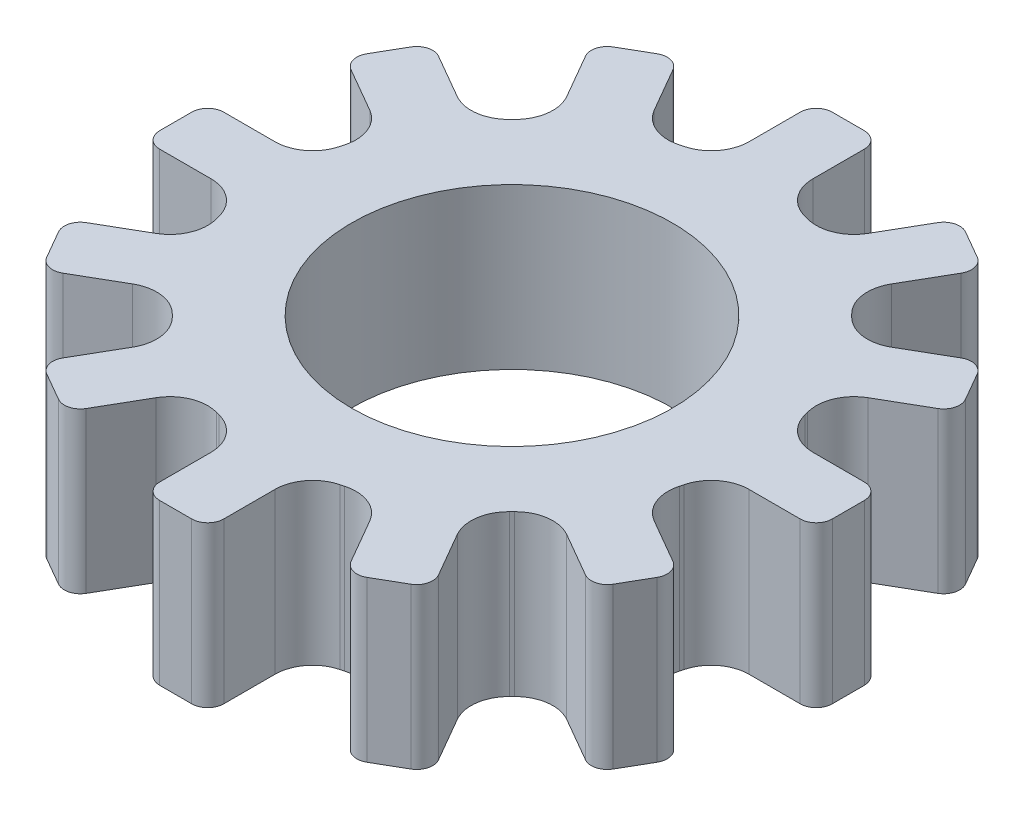
from build123d import *

# Parameters (mm, degrees)
SKETCH1_R           = 6.3627
BOSS_EXTRUDE1_DEPTH = 6.35


with BuildPart() as part:
    # Sketch1 → Boss-Extrude1 (new body)
    with BuildSketch(Plane(origin=(0, 0, 0), x_dir=(1, 0, 0), z_dir=(0, 1, 0))):
        with BuildLine():
            Line((-1.27, 10.670267616), (-1.27, 12.7))
            ThreePointArc((-1.27, 12.7), (-1.084012806, 13.149012806), (-0.635, 13.335))
            Line((-0.635, 13.335), (0.635, 13.335))
            ThreePointArc((0.635, 13.335), (1.084012806, 13.149012806), (1.27, 12.7))
            Line((1.27, 12.7), (1.27, 10.670267616))
            ThreePointArc((1.27, 10.670267616), (1.583306834, 9.753271395), (2.392223502, 9.219701281))
            Line((2.392223502, 9.219701281), (2.538124316, 9.180607276))
            ThreePointArc((2.538124316, 9.180607276), (3.505451757, 9.238234215), (4.235281545, 9.875722821))
            Line((4.235281545, 9.875722821), (5.250147737, 11.633522628))
            ThreePointArc((5.250147737, 11.633522628), (5.635723775, 11.929385528), (6.117573869, 11.865948759))
            Line((6.117573869, 11.865948759), (7.217426131, 11.230948759))
            ThreePointArc((7.217426131, 11.230948759), (7.513289031, 10.845372722), (7.449852263, 10.363522628))
            Line((7.449852263, 10.363522628), (6.434986071, 8.605722821))
            ThreePointArc((6.434986071, 8.605722821), (6.247819637, 7.654927381), (6.681576965, 6.788383774))
            Line((6.681576965, 6.788383774), (6.788383774, 6.681576965))
            ThreePointArc((6.788383774, 6.681576965), (7.654927381, 6.247819637), (8.605722821, 6.434986071))
            Line((8.605722821, 6.434986071), (10.363522628, 7.449852263))
            ThreePointArc((10.363522628, 7.449852263), (10.845372722, 7.513289031), (11.230948759, 7.217426131))
            Line((11.230948759, 7.217426131), (11.865948759, 6.117573869))
            ThreePointArc((11.865948759, 6.117573869), (11.929385528, 5.635723775), (11.633522628, 5.250147737))
            Line((11.633522628, 5.250147737), (9.875722821, 4.235281545))
            ThreePointArc((9.875722821, 4.235281545), (9.238234215, 3.505451757), (9.180607276, 2.538124316))
            Line((9.180607276, 2.538124316), (9.219701281, 2.392223502))
            ThreePointArc((9.219701281, 2.392223502), (9.753271395, 1.583306834), (10.670267616, 1.27))
            Line((10.670267616, 1.27), (12.7, 1.27))
            ThreePointArc((12.7, 1.27), (13.149012806, 1.084012806), (13.335, 0.635))
            Line((13.335, 0.635), (13.335, -0.635))
            ThreePointArc((13.335, -0.635), (13.149012806, -1.084012806), (12.7, -1.27))
            Line((12.7, -1.27), (10.670267616, -1.27))
            ThreePointArc((10.670267616, -1.27), (9.753271395, -1.583306834), (9.219701281, -2.392223502))
            Line((9.219701281, -2.392223502), (9.180607276, -2.538124316))
            ThreePointArc((9.180607276, -2.538124316), (9.238234215, -3.505451757), (9.875722821, -4.235281545))
            Line((9.875722821, -4.235281545), (11.633522628, -5.250147737))
            ThreePointArc((11.633522628, -5.250147737), (11.929385528, -5.635723775), (11.865948759, -6.117573869))
            Line((11.865948759, -6.117573869), (11.230948759, -7.217426131))
            ThreePointArc((11.230948759, -7.217426131), (10.845372722, -7.513289031), (10.363522628, -7.449852263))
            Line((10.363522628, -7.449852263), (8.605722821, -6.434986071))
            ThreePointArc((8.605722821, -6.434986071), (7.654927381, -6.247819637), (6.788383774, -6.681576965))
            Line((6.788383774, -6.681576965), (6.681576965, -6.788383774))
            ThreePointArc((6.681576965, -6.788383774), (6.247819637, -7.654927381), (6.434986071, -8.605722821))
            Line((6.434986071, -8.605722821), (7.449852263, -10.363522628))
            ThreePointArc((7.449852263, -10.363522628), (7.513289031, -10.845372722), (7.217426131, -11.230948759))
            Line((7.217426131, -11.230948759), (6.117573869, -11.865948759))
            ThreePointArc((6.117573869, -11.865948759), (5.635723775, -11.929385528), (5.250147737, -11.633522628))
            Line((5.250147737, -11.633522628), (4.235281545, -9.875722821))
            ThreePointArc((4.235281545, -9.875722821), (3.505451757, -9.238234215), (2.538124316, -9.180607276))
            Line((2.538124316, -9.180607276), (2.392223502, -9.219701281))
            ThreePointArc((2.392223502, -9.219701281), (1.583306834, -9.753271395), (1.27, -10.670267616))
            Line((1.27, -10.670267616), (1.27, -12.7))
            ThreePointArc((1.27, -12.7), (1.084012806, -13.149012806), (0.635, -13.335))
            Line((0.635, -13.335), (-0.635, -13.335))
            ThreePointArc((-0.635, -13.335), (-1.084012806, -13.149012806), (-1.27, -12.7))
            Line((-1.27, -12.7), (-1.27, -10.670267616))
            ThreePointArc((-1.27, -10.670267616), (-1.583306834, -9.753271395), (-2.392223502, -9.219701281))
            Line((-2.392223502, -9.219701281), (-2.538124316, -9.180607276))
            ThreePointArc((-2.538124316, -9.180607276), (-3.505451757, -9.238234215), (-4.235281545, -9.875722821))
            Line((-4.235281545, -9.875722821), (-5.250147737, -11.633522628))
            ThreePointArc((-5.250147737, -11.633522628), (-5.635723775, -11.929385528), (-6.117573869, -11.865948759))
            Line((-6.117573869, -11.865948759), (-7.217426131, -11.230948759))
            ThreePointArc((-7.217426131, -11.230948759), (-7.513289031, -10.845372722), (-7.449852263, -10.363522628))
            Line((-7.449852263, -10.363522628), (-6.434986071, -8.605722821))
            ThreePointArc((-6.434986071, -8.605722821), (-6.247819637, -7.654927381), (-6.681576965, -6.788383774))
            Line((-6.681576965, -6.788383774), (-6.788383774, -6.681576965))
            ThreePointArc((-6.788383774, -6.681576965), (-7.654927381, -6.247819637), (-8.605722821, -6.434986071))
            Line((-8.605722821, -6.434986071), (-10.363522628, -7.449852263))
            ThreePointArc((-10.363522628, -7.449852263), (-10.845372722, -7.513289031), (-11.230948759, -7.217426131))
            Line((-11.230948759, -7.217426131), (-11.865948759, -6.117573869))
            ThreePointArc((-11.865948759, -6.117573869), (-11.929385528, -5.635723775), (-11.633522628, -5.250147737))
            Line((-11.633522628, -5.250147737), (-9.875722821, -4.235281545))
            ThreePointArc((-9.875722821, -4.235281545), (-9.238234215, -3.505451757), (-9.180607276, -2.538124316))
            Line((-9.180607276, -2.538124316), (-9.219701281, -2.392223502))
            ThreePointArc((-9.219701281, -2.392223502), (-9.753271395, -1.583306834), (-10.670267616, -1.27))
            Line((-10.670267616, -1.27), (-12.7, -1.27))
            ThreePointArc((-12.7, -1.27), (-13.149012806, -1.084012806), (-13.335, -0.635))
            Line((-13.335, -0.635), (-13.335, 0.635))
            ThreePointArc((-13.335, 0.635), (-13.149012806, 1.084012806), (-12.7, 1.27))
            Line((-12.7, 1.27), (-10.670267616, 1.27))
            ThreePointArc((-10.670267616, 1.27), (-9.753271395, 1.583306834), (-9.219701281, 2.392223502))
            Line((-9.219701281, 2.392223502), (-9.180607276, 2.538124316))
            ThreePointArc((-9.180607276, 2.538124316), (-9.238234215, 3.505451757), (-9.875722821, 4.235281545))
            Line((-9.875722821, 4.235281545), (-11.633522628, 5.250147737))
            ThreePointArc((-11.633522628, 5.250147737), (-11.929385528, 5.635723775), (-11.865948759, 6.117573869))
            Line((-11.865948759, 6.117573869), (-11.230948759, 7.217426131))
            ThreePointArc((-11.230948759, 7.217426131), (-10.845372722, 7.513289031), (-10.363522628, 7.449852263))
            Line((-10.363522628, 7.449852263), (-8.605722821, 6.434986071))
            ThreePointArc((-8.605722821, 6.434986071), (-7.654927381, 6.247819637), (-6.788383774, 6.681576965))
            Line((-6.788383774, 6.681576965), (-6.681576965, 6.788383774))
            ThreePointArc((-6.681576965, 6.788383774), (-6.247819637, 7.654927381), (-6.434986071, 8.605722821))
            Line((-6.434986071, 8.605722821), (-7.449852263, 10.363522628))
            ThreePointArc((-7.449852263, 10.363522628), (-7.513289031, 10.845372722), (-7.217426131, 11.230948759))
            Line((-7.217426131, 11.230948759), (-6.117573869, 11.865948759))
            ThreePointArc((-6.117573869, 11.865948759), (-5.635723775, 11.929385528), (-5.250147737, 11.633522628))
            Line((-5.250147737, 11.633522628), (-4.235281545, 9.875722821))
            ThreePointArc((-4.235281545, 9.875722821), (-3.505451757, 9.238234215), (-2.538124316, 9.180607276))
            Line((-2.538124316, 9.180607276), (-2.392223502, 9.219701281))
            ThreePointArc((-2.392223502, 9.219701281), (-1.583306834, 9.753271395), (-1.27, 10.670267616))
        make_face()
        with Locations(Location((0, 0, 0), (0, 0, 270))):
            Circle(SKETCH1_R, mode=Mode.SUBTRACT)
    extrude(amount=BOSS_EXTRUDE1_DEPTH)


solid = part.part
